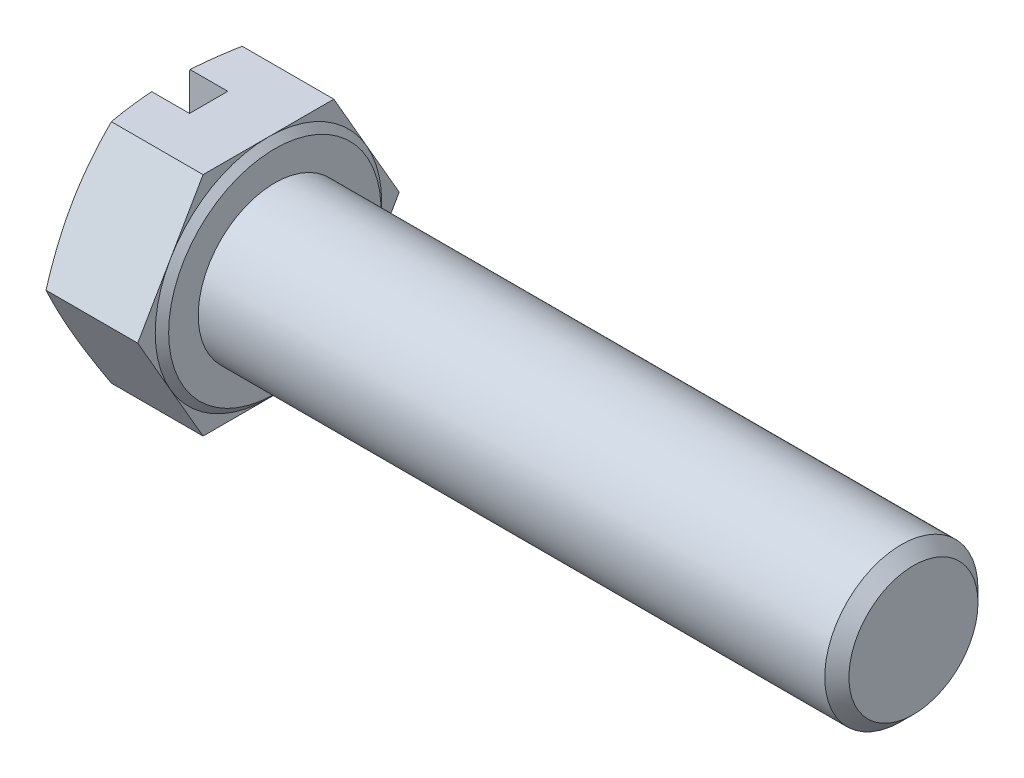
from build123d import *

# Parameters (mm, degrees)
BASEHEAD_DEPTH  = 7.68
SKETCH3_R       = 6
BASEBODY_DEPTH  = 50
CHAMFER1_SIZE   = 0.947
SLOT_DEPTH      = 60.735123043
SLOT_DEPTH_BACK = 60.735123043
SKETCH5_W       = 3
SKETCH5_H       = 3


with BuildPart() as part:
    # Sketch-BaseHead → BaseHead (new body)
    with BuildSketch(Plane(origin=(0, 0, 0), x_dir=(0, 0, -1), z_dir=(1, 0, 0))):
        Polygon((5.118210136, -8.865), (10.236420273, 0), (5.118210136, 8.865), (-5.118210136, 8.865), (-10.236420273, 0), (-5.118210136, -8.865), align=None)
    extrude(amount=BASEHEAD_DEPTH)

    # Sketch1 → Revolve1 (revolve)
    with BuildSketch(Plane.XY, mode=Mode.PRIVATE) as revolve1_sk:
        Polygon((7.68, 0), (8.18, 0), (8.18, -8.315), (7.68, -8.865), align=None)
    revolve(revolve1_sk.sketch.rotate(Axis((-4.001564945, 0, 0), (1, 0, 0)), 270), axis=Axis((-4.001564945, 0, 0), (1, 0, 0)))

    # Sketch3 → BaseBody (add)
    with BuildSketch(Plane(origin=(8.18, 0, 0), x_dir=(0, 0, -1), z_dir=(1, 0, 0))):
        Circle(SKETCH3_R)
    extrude(amount=BASEBODY_DEPTH)

    # Chamfer1
    chamfer1_edges = [part.edges().sort_by_distance(p)[0] for p in [
        (58.18, 0, 6),
    ]]
    chamfer(chamfer1_edges, length=CHAMFER1_SIZE)

    # Sketch4 → HeadChamfer (revolve, cut)
    with BuildSketch(Plane(origin=(-0.264637255, 0, 5.916896391), x_dir=(0, 0, -1), z_dir=(0, 1, 0))):
        Polygon((16.153316664, -0.264637255), (14.781896391, -0.264637255), (16.153316664, -0.763793413), align=None)
    revolve(axis=Axis((-4.001564945, 0, 0), (1, 0, 0)), mode=Mode.SUBTRACT)

    # Sketch5 → Slot (cut, two sides: drawn at the far end of the back side and taken through both)
    with BuildSketch(Plane(origin=(0, 0, 0), x_dir=(1, 0, 0), z_dir=(0, 1, 0)).offset(-SLOT_DEPTH_BACK)):
        with Locations((1.5, 0)):
            Rectangle(SKETCH5_W, SKETCH5_H)
    extrude(amount=SLOT_DEPTH + SLOT_DEPTH_BACK, mode=Mode.SUBTRACT)


solid = part.part
